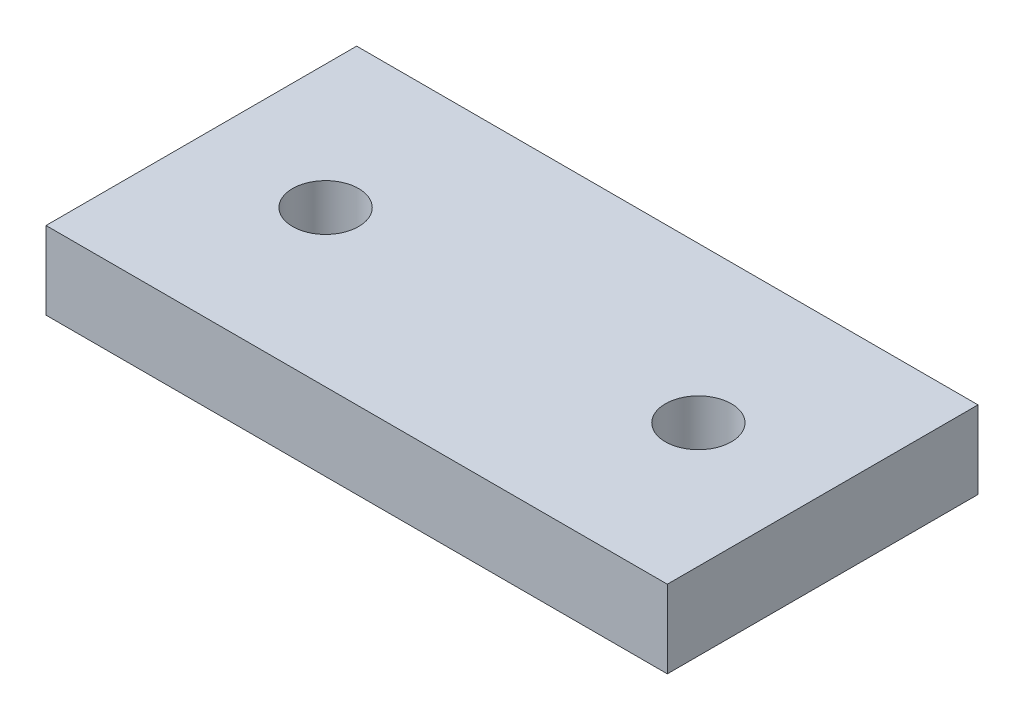
from build123d import *

# Parameters (mm, degrees)
SKETCH1_W           = 40
SKETCH1_H           = 20
SKETCH1_R           = 2.125
BOSS_EXTRUDE1_DEPTH = 5


with BuildPart() as part:
    # Sketch1 → Boss-Extrude1 (new body)
    with BuildSketch(Plane(origin=(0, 0, 0), x_dir=(1, 0, 0), z_dir=(0, 1, 0))):
        Rectangle(SKETCH1_W, SKETCH1_H)
        with Locations(Location((-12, 0, 0), (0, 0, 270))):
            Circle(SKETCH1_R, mode=Mode.SUBTRACT)
        with Locations(Location((12, 0, 0), (0, 0, 90))):
            Circle(SKETCH1_R, mode=Mode.SUBTRACT)
    extrude(amount=BOSS_EXTRUDE1_DEPTH)


solid = part.part
